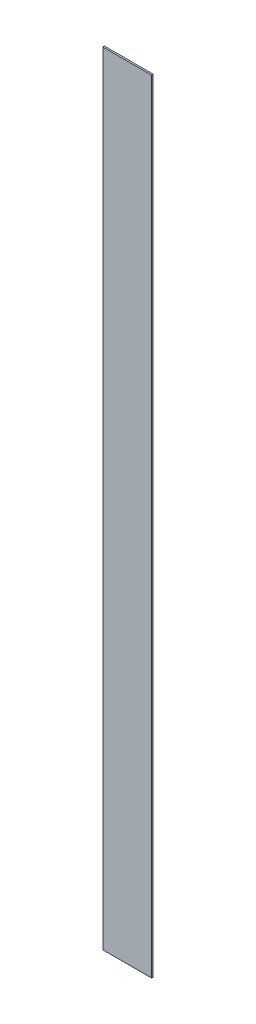
from build123d import *

# Parameters (mm, degrees)
SKETCH1_W           = 75
SKETCH1_H           = 1200
BOSS_EXTRUDE1_DEPTH = 2.5


with BuildPart() as part:
    # Sketch1 → Boss-Extrude1 (new body)
    with BuildSketch(Plane.XY):
        Rectangle(SKETCH1_W, SKETCH1_H)
    extrude(amount=BOSS_EXTRUDE1_DEPTH)


solid = part.part
